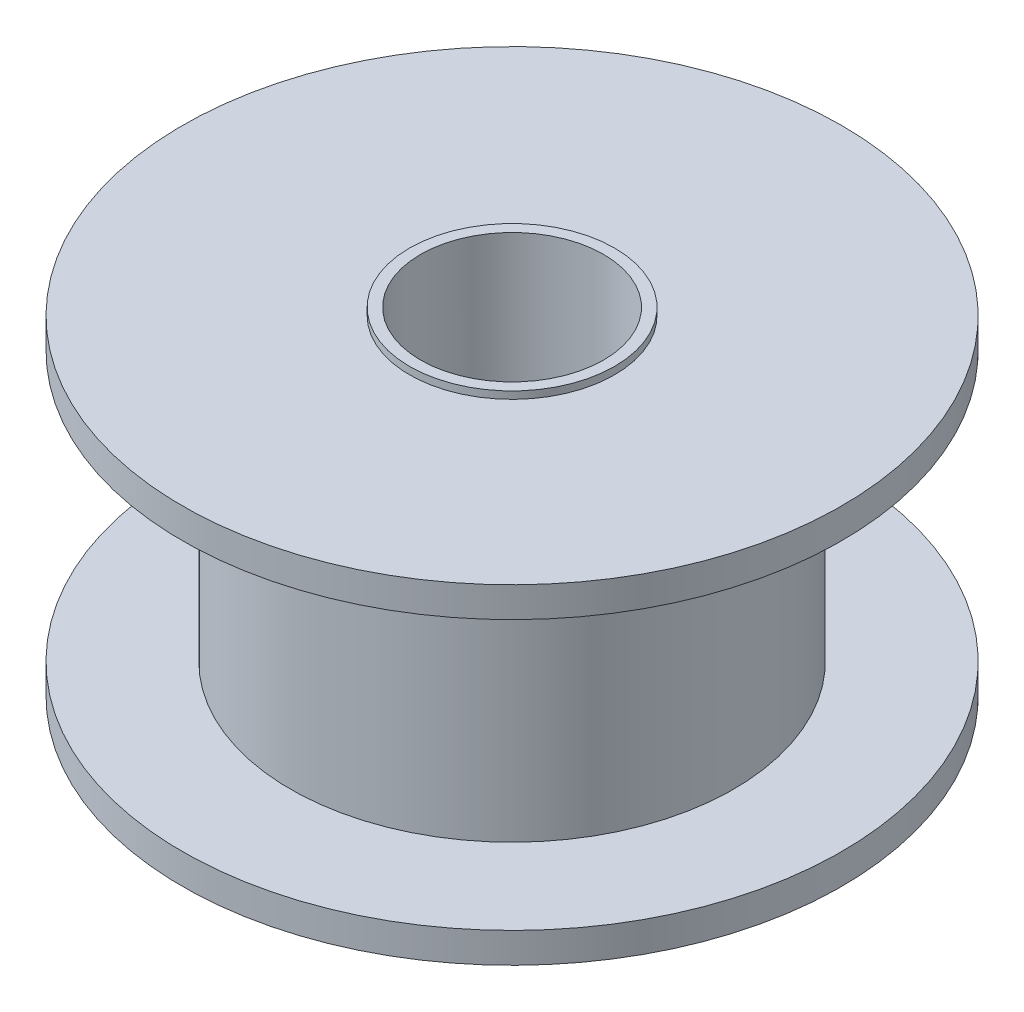
from build123d import *

# Parameters (mm, degrees)
ESBO_O2_R                = 2.8
ESBO_O2_R_2              = 2.5
RESSALTO_EXTRUS_O1_DEPTH = 0.2
RESSALTO_EXTRUS_O2_START = 0.2
ESBO_O4_R                = 2.8
ESBO_O4_R_2              = 2.5
RESSALTO_EXTRUS_O2_DEPTH = 0.2


with BuildPart() as part:
    # Esboço1 → Revolução1 (revolve)
    with BuildSketch(Plane.XY, mode=Mode.PRIVATE) as revolu_o1_sk:
        Polygon((-9, -4.5), (-9, -3.675), (-6.05, -3.675), (-6.05, 3.675), (-9, 3.675), (-9, 4.5), (-2.5, 4.5), (-2.5, -4.5), align=None)
    revolve(revolu_o1_sk.sketch.rotate(Axis((0, 0, 0), (0, 1, 0)), 270), axis=Axis((0, 0, 0), (0, 1, 0)))

    # Esboço2 → Ressalto-extrusão1 (add)
    with BuildSketch(Plane(origin=(0, 4.5, 0), x_dir=(1, 0, 0), z_dir=(0, 1, 0))):
        with Locations(Location((0, 0, 0), (0, 0, 90))):
            Circle(ESBO_O2_R)
        with Locations(Location((0, 0, 0), (0, 0, 90))):
            Circle(ESBO_O2_R_2, mode=Mode.SUBTRACT)
    extrude(amount=RESSALTO_EXTRUS_O1_DEPTH)

    # Esboço4 → Ressalto-extrusão2 (add)
    with BuildSketch(Plane.XZ.offset(4.5).offset(RESSALTO_EXTRUS_O2_START)):
        with Locations(Location((0, 0, 0), (0, 0, 270))):
            Circle(ESBO_O4_R)
        with Locations(Location((0, 0, 0), (0, 0, 270))):
            Circle(ESBO_O4_R_2, mode=Mode.SUBTRACT)
    extrude(amount=-RESSALTO_EXTRUS_O2_DEPTH)


solid = part.part
